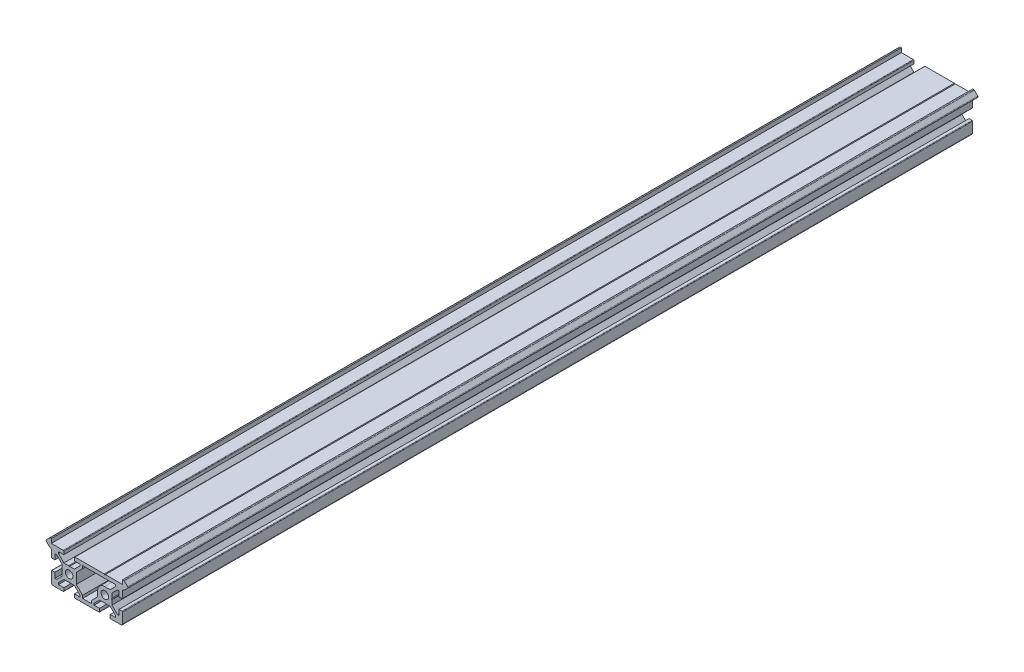
from build123d import *

# Parameters (mm, degrees)
MODEL_R             = 2.100000001
BOSS_EXTRUDE1_DEPTH = 476.36


with BuildPart() as part:
    # Model → Boss-Extrude1 (new body)
    with BuildSketch(Plane.XY):
        with BuildLine():
            Line((28.771485975, 48.105572105), (30.646485975, 49.980572105))
            ThreePointArc((30.646485975, 49.980572105), (30.808697649, 50.08895848), (31.000039365, 50.127018713))
            Line((31.000039365, 50.127018713), (31.592932584, 50.127018713))
            Line((31.592932584, 50.127018713), (31.592932584, 47.752018713))
            Line((31.592932584, 47.752018713), (38.292932585, 47.752018713))
            ThreePointArc((38.292932585, 47.752018713), (38.505064619, 47.664150748), (38.592932584, 47.452018714))
            Line((38.592932584, 47.452018714), (38.592932584, 45.752018713))
            Line((38.592932584, 45.752018713), (35.592932585, 45.752018713))
            Line((35.592932585, 45.752018713), (35.592932585, 44.812678885))
            Line((35.592932585, 44.812678885), (38.653592756, 41.752018713))
            Line((38.653592756, 41.752018713), (41.292932583, 41.752018713))
            Line((41.292932583, 41.752018713), (41.592932584, 41.452018713))
            Line((41.592932584, 41.452018713), (41.892932586, 41.752018714))
            Line((41.892932586, 41.752018714), (44.532272412, 41.752018714))
            Line((44.532272412, 41.752018714), (47.592932584, 44.812678886))
            Line((47.592932584, 44.812678886), (47.592932584, 45.752018714))
            Line((47.592932584, 45.752018714), (44.592932584, 45.752018714))
            Line((44.592932584, 45.752018714), (44.592932584, 47.452018715))
            ThreePointArc((44.592932584, 47.452018715), (44.68080055, 47.664150749), (44.892932584, 47.752018715))
            Line((44.892932584, 47.752018715), (61.292932583, 47.752018715))
            Line((61.292932583, 47.752018715), (61.592932582, 47.452018715))
            Line((61.592932582, 47.452018715), (61.892932583, 47.752018716))
            Line((61.892932583, 47.752018716), (71.592932583, 47.752018716))
            Line((71.592932583, 47.752018716), (71.592932583, 50.127018711))
            Line((71.592932583, 50.127018711), (72.185825802, 50.127018711))
            ThreePointArc((72.185825802, 50.127018711), (72.377167518, 50.088958477), (72.539379192, 49.980572102))
            Line((72.539379192, 49.980572102), (74.414379192, 48.105572102))
            ThreePointArc((74.414379192, 48.105572102), (74.560825801, 47.752018712), (74.414379192, 47.398465322))
            Line((74.414379192, 47.398465322), (72.539379192, 45.523465322))
            ThreePointArc((72.539379192, 45.523465322), (72.377167518, 45.415078947), (72.185825802, 45.377018714))
            Line((72.185825802, 45.377018714), (72.092932582, 45.377018714))
            ThreePointArc((72.092932582, 45.377018714), (71.739379192, 45.230572103), (71.592932583, 44.877018713))
            Line((71.592932583, 44.877018713), (71.592932583, 41.052018712))
            ThreePointArc((71.592932583, 41.052018712), (71.505064617, 40.839886678), (71.292932581, 40.752018713))
            Line((71.292932581, 40.752018713), (69.592932583, 40.752018713))
            Line((69.592932583, 40.752018713), (69.592932583, 43.752018712))
            Line((69.592932583, 43.752018712), (68.653592755, 43.752018712))
            Line((68.653592755, 43.752018712), (65.592932583, 40.691358541))
            Line((65.592932583, 40.691358541), (65.592932583, 38.052018712))
            Line((65.592932583, 38.052018712), (65.292932584, 37.752018712))
            Line((65.292932584, 37.752018712), (65.592932583, 37.452018713))
            Line((65.592932583, 37.452018713), (65.592932583, 34.812678884))
            Line((65.592932583, 34.812678884), (68.653592755, 31.752018712))
            Line((68.653592755, 31.752018712), (69.592932583, 31.752018712))
            Line((69.592932583, 31.752018712), (69.592932583, 34.752018711))
            Line((69.592932583, 34.752018711), (71.292932581, 34.752018711))
            ThreePointArc((71.292932581, 34.752018711), (71.505064617, 34.664150747), (71.592932583, 34.452018712))
            Line((71.592932583, 34.452018712), (71.592932583, 28.75201871))
            ThreePointArc((71.592932583, 28.75201871), (71.300039364, 28.044911929), (70.592932582, 27.752018711))
            Line((70.592932582, 27.752018711), (64.892932582, 27.752018711))
            ThreePointArc((64.892932582, 27.752018711), (64.680800548, 27.839886676), (64.592932583, 28.05201871))
            Line((64.592932583, 28.05201871), (64.592932583, 29.752018711))
            Line((64.592932583, 29.752018711), (67.592932582, 29.752018711))
            Line((67.592932582, 29.752018711), (67.592932582, 30.69135854))
            Line((67.592932582, 30.69135854), (64.532272411, 33.752018711))
            Line((64.532272411, 33.752018711), (61.892932584, 33.752018711))
            Line((61.892932584, 33.752018711), (61.592932582, 34.052018713))
            Line((61.592932582, 34.052018713), (61.292932582, 33.752018712))
            Line((61.292932582, 33.752018712), (58.653592755, 33.752018712))
            Line((58.653592755, 33.752018712), (55.592932583, 30.691358541))
            Line((55.592932583, 30.691358541), (55.592932583, 29.752018713))
            Line((55.592932583, 29.752018713), (58.592932583, 29.752018713))
            Line((58.592932583, 29.752018713), (58.592932583, 28.052018712))
            ThreePointArc((58.592932583, 28.052018712), (58.505064617, 27.839886678), (58.292932583, 27.752018712))
            Line((58.292932583, 27.752018712), (44.892932584, 27.752018712))
            ThreePointArc((44.892932584, 27.752018712), (44.68080055, 27.839886678), (44.592932584, 28.052018712))
            Line((44.592932584, 28.052018712), (44.592932584, 29.752018713))
            Line((44.592932584, 29.752018713), (47.592932584, 29.752018713))
            Line((47.592932584, 29.752018713), (47.592932584, 30.691358541))
            Line((47.592932584, 30.691358541), (44.532272412, 33.752018712))
            Line((44.532272412, 33.752018712), (41.892932586, 33.752018712))
            Line((41.892932586, 33.752018712), (41.592932584, 34.052018714))
            Line((41.592932584, 34.052018714), (41.292932583, 33.752018714))
            Line((41.292932583, 33.752018714), (38.653592756, 33.752018714))
            Line((38.653592756, 33.752018714), (35.592932585, 30.691358542))
            Line((35.592932585, 30.691358542), (35.592932585, 29.752018714))
            Line((35.592932585, 29.752018714), (38.592932584, 29.752018714))
            Line((38.592932584, 29.752018714), (38.592932584, 28.052018713))
            ThreePointArc((38.592932584, 28.052018713), (38.505064619, 27.839886679), (38.292932585, 27.752018714))
            Line((38.292932585, 27.752018714), (32.592932585, 27.752018714))
            ThreePointArc((32.592932585, 27.752018714), (31.885825803, 28.044911931), (31.592932584, 28.752018713))
            Line((31.592932584, 28.752018713), (31.592932584, 34.452018715))
            ThreePointArc((31.592932584, 34.452018715), (31.68080055, 34.664150748), (31.892932583, 34.752018714))
            Line((31.892932583, 34.752018714), (33.592932584, 34.752018714))
            Line((33.592932584, 34.752018714), (33.592932584, 31.752018715))
            Line((33.592932584, 31.752018715), (34.532272412, 31.752018715))
            Line((34.532272412, 31.752018715), (37.592932584, 34.812678886))
            Line((37.592932584, 34.812678886), (37.592932584, 37.452018715))
            Line((37.592932584, 37.452018715), (37.892932583, 37.752018715))
            Line((37.892932583, 37.752018715), (37.592932584, 38.052018714))
            Line((37.592932584, 38.052018714), (37.592932584, 40.691358543))
            Line((37.592932584, 40.691358543), (34.532272412, 43.752018715))
            Line((34.532272412, 43.752018715), (33.592932584, 43.752018715))
            Line((33.592932584, 43.752018715), (33.592932584, 40.752018716))
            Line((33.592932584, 40.752018716), (31.892932586, 40.752018716))
            ThreePointArc((31.892932586, 40.752018716), (31.68080055, 40.83988668), (31.592932584, 41.052018715))
            Line((31.592932584, 41.052018715), (31.592932584, 44.877018715))
            ThreePointArc((31.592932584, 44.877018715), (31.446485975, 45.230572106), (31.092932585, 45.377018716))
            Line((31.092932585, 45.377018716), (31.000039365, 45.377018716))
            ThreePointArc((31.000039365, 45.377018716), (30.808697649, 45.41507895), (30.646485975, 45.523465324))
            Line((30.646485975, 45.523465324), (28.771485975, 47.398465325))
            ThreePointArc((28.771485975, 47.398465325), (28.625039366, 47.752018715), (28.771485975, 48.105572105))
        make_face()
        with Locations((61.592932582, 37.752018715)):
            Circle(MODEL_R, mode=Mode.SUBTRACT)
        with Locations((41.592932582, 37.752018715)):
            Circle(MODEL_R, mode=Mode.SUBTRACT)
        with BuildLine():
            Line((54.092932584, 29.752018715), (49.092932584, 29.752018715))
            Line((49.092932584, 29.752018715), (49.092932584, 31.312678886))
            Line((49.092932584, 31.312678886), (45.592932583, 34.812678886))
            Line((45.592932583, 34.812678886), (45.592932583, 40.691358543))
            Line((45.592932583, 40.691358543), (49.092932584, 44.191358544))
            Line((49.092932584, 44.191358544), (49.092932584, 45.752018714))
            Line((49.092932584, 45.752018714), (67.592932582, 45.752018714))
            Line((67.592932582, 45.752018714), (67.592932582, 44.812678887))
            Line((67.592932582, 44.812678887), (64.532272411, 41.752018716))
            Line((64.532272411, 41.752018716), (61.402932584, 41.752018716))
            ThreePointArc((61.402932584, 41.752018716), (58.708855747, 40.636095552), (57.592932584, 37.942018716))
            Line((57.592932584, 37.942018716), (57.592932584, 34.812678886))
            Line((57.592932584, 34.812678886), (54.092932584, 31.312678886))
            Line((54.092932584, 31.312678886), (54.092932584, 29.752018715))
        make_face(mode=Mode.SUBTRACT)
    extrude(amount=BOSS_EXTRUDE1_DEPTH)


solid = part.part
